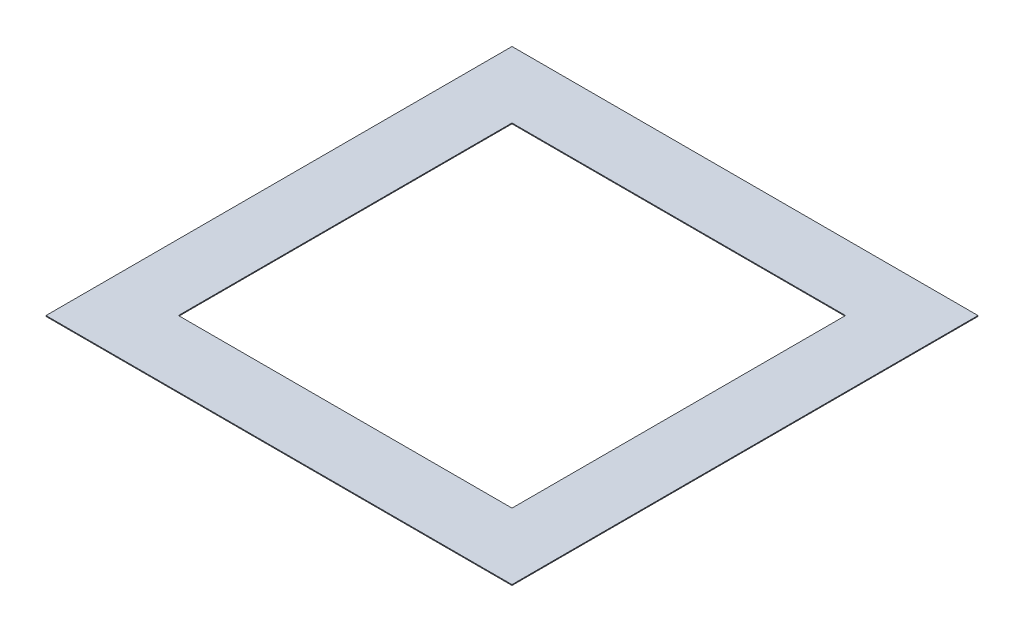
from build123d import *

# Parameters (mm, degrees)
SKETCH1_W           = 139.7
SKETCH1_H           = 139.7
SKETCH1_W_2         = 100
SKETCH1_H_2         = 100
BOSS_EXTRUDE1_DEPTH = 0.125


with BuildPart() as part:
    # Sketch1 → Boss-Extrude1 (new, symmetric)
    with BuildSketch(Plane(origin=(0, 0, 0), x_dir=(1, 0, 0), z_dir=(0, 1, 0))):
        Rectangle(SKETCH1_W, SKETCH1_H)
        Rectangle(SKETCH1_W_2, SKETCH1_H_2, mode=Mode.SUBTRACT)
    extrude(amount=BOSS_EXTRUDE1_DEPTH, both=True)


solid = part.part
